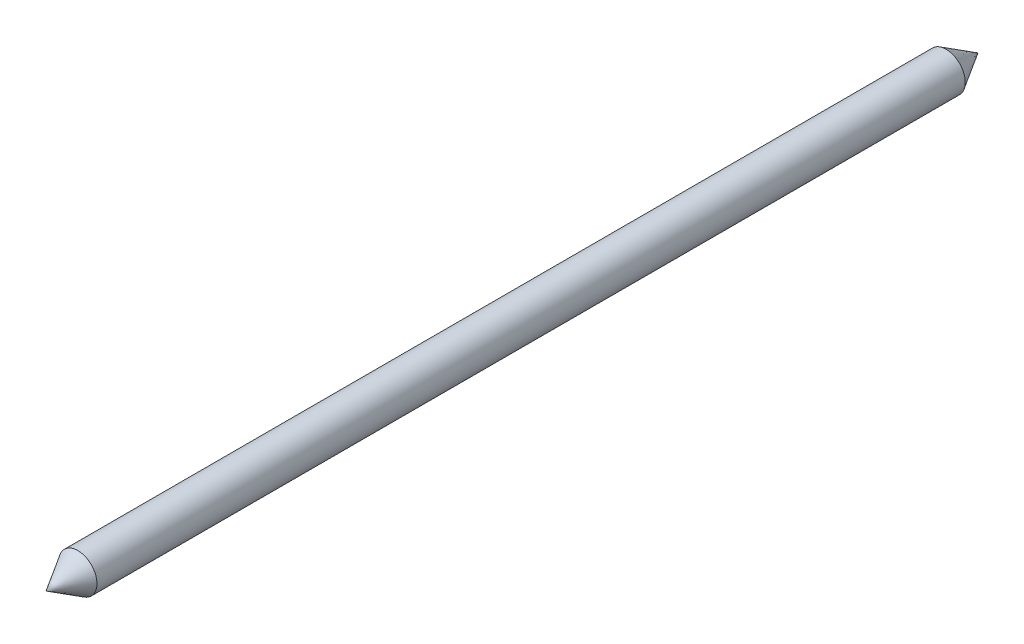
from build123d import *


with BuildPart() as part:
    # Sketch2 → Revolve1 (revolve)
    with BuildSketch(Plane(origin=(0, 0, 0), x_dir=(1, 0, 0), z_dir=(0, 1, 0))):
        Polygon((7.62, 173.0375), (7.62, -173.0375), (0, -185.7375), (0, 185.7375), align=None)
    revolve(axis=Axis((0, 0, 185.7375), (0, 0, -1)))


solid = part.part
